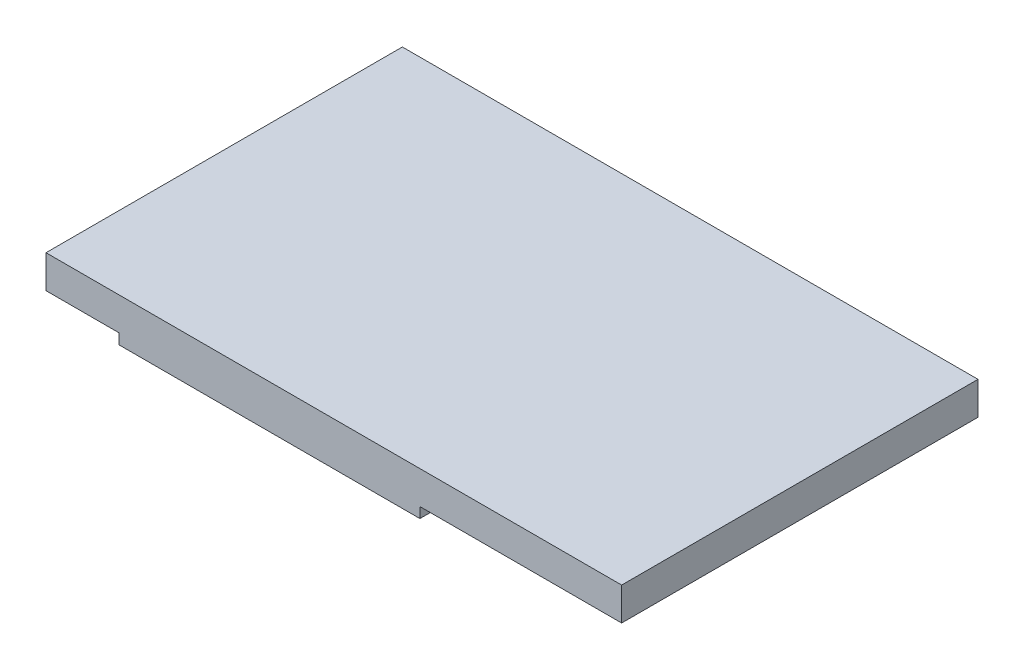
from build123d import *

# Parameters (mm, degrees)
SKETCH1_W           = 105
SKETCH1_H           = 65
BOSS_EXTRUDE1_DEPTH = 6
SKETCH3_W           = 54.9
SKETCH3_H           = 65
BOSS_EXTRUDE3_DEPTH = 1.9
SKETCH4_W           = 2.4
SKETCH4_H           = 24.2
SKETCH4_H_2         = 39.7
BOSS_EXTRUDE4_DEPTH = 3.1


with BuildPart() as part:
    # Sketch1 → Boss-Extrude1 (new body)
    with BuildSketch(Plane(origin=(0, 0, 0), x_dir=(1, 0, 0), z_dir=(0, 1, 0))):
        Rectangle(SKETCH1_W, SKETCH1_H)
    extrude(amount=BOSS_EXTRUDE1_DEPTH)

    # Sketch3 → Boss-Extrude3 (add)
    with BuildSketch(Plane.XZ):
        with Locations((-11.75, 0)):
            Rectangle(SKETCH3_W, SKETCH3_H)
    extrude(amount=BOSS_EXTRUDE3_DEPTH)

    # Sketch4 → Boss-Extrude4 (add)
    with BuildSketch(Plane.XZ.offset(1.9)):
        with Locations((-34.7, 15.1)):
            Rectangle(SKETCH4_W, SKETCH4_H)
        with Locations((9.453936311, 7.35)):
            Rectangle(SKETCH4_W, SKETCH4_H_2)
    extrude(amount=BOSS_EXTRUDE4_DEPTH)


solid = part.part
